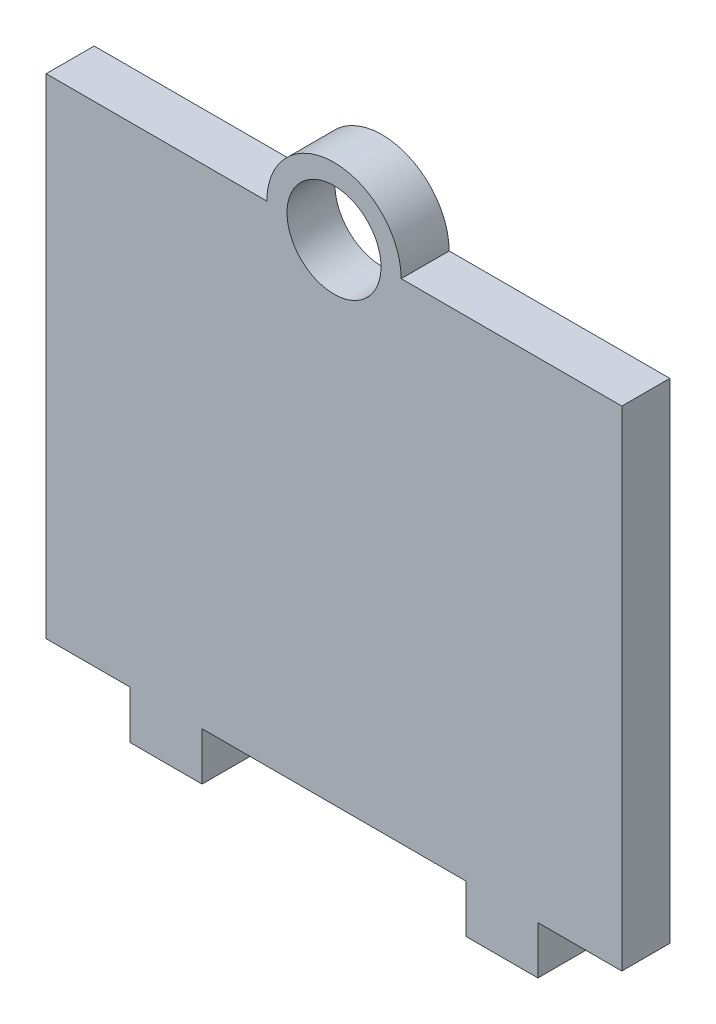
from build123d import *

# Parameters (mm, degrees)
SKETCH1_R      = 12.446
EXTRUDE1_DEPTH = 12.7


with BuildPart() as part:
    # Sketch1 → Extrude1 (new body)
    with BuildSketch(Plane.XY):
        with BuildLine():
            Line((-76.2, 142.24), (-17.78, 142.24))
            ThreePointArc((-17.78, 142.24), (0, 160.02), (17.78, 142.24))
            Line((17.78, 142.24), (76.2, 142.24))
            Line((76.2, 142.24), (76.2, 12.7))
            Line((76.2, 12.7), (53.975, 12.7))
            Line((53.975, 12.7), (53.975, 0))
            Line((53.975, 0), (34.925, 0))
            Line((34.925, 0), (34.925, 12.7))
            Line((34.925, 12.7), (-34.925, 12.7))
            Line((-34.925, 12.7), (-34.925, 0))
            Line((-34.925, 0), (-53.975, 0))
            Line((-53.975, 0), (-53.975, 12.7))
            Line((-53.975, 12.7), (-76.2, 12.7))
            Line((-76.2, 12.7), (-76.2, 142.24))
        make_face()
        with Locations((0, 142.24)):
            Circle(SKETCH1_R, mode=Mode.SUBTRACT)
    extrude(amount=-EXTRUDE1_DEPTH)


solid = part.part
